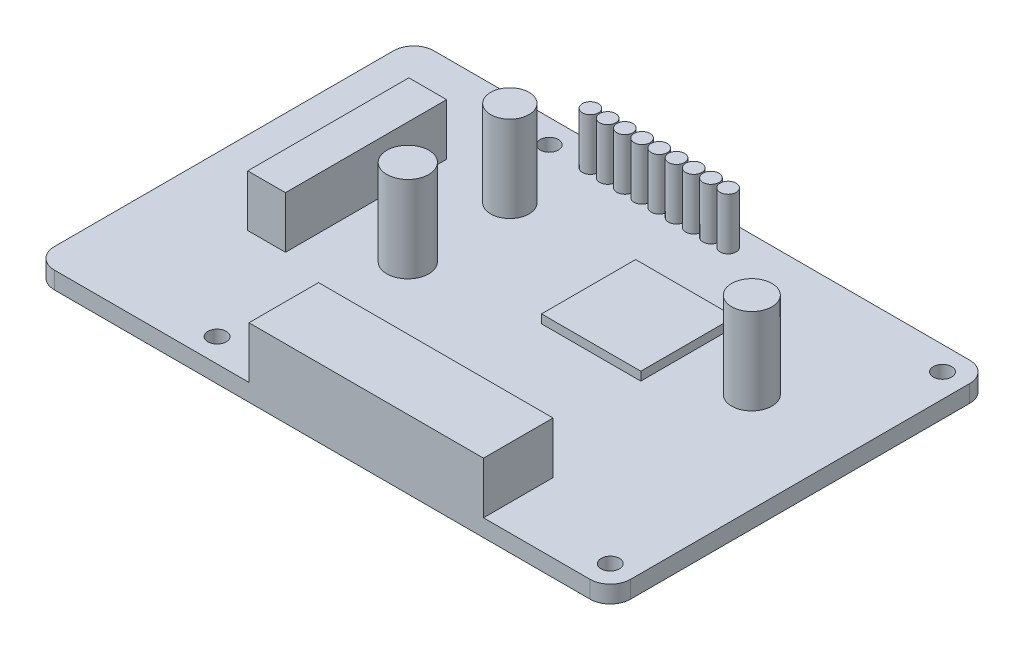
from build123d import *

# Parameters (mm, degrees)
SKETCH1_R           = 1.35
BOSS_EXTRUDE1_DEPTH = 2.54
SKETCH2_W           = 34.5908584
SKETCH2_H           = 10.2596717
BOSS_EXTRUDE2_DEPTH = 7.62
SKETCH3_W           = 5.570985132
SKETCH3_H           = 23.769243549
BOSS_EXTRUDE3_DEPTH = 7.62
SKETCH4_W           = 14.639482868
SKETCH4_H           = 13.879415804
BOSS_EXTRUDE4_DEPTH = 1.27
SKETCH5_R           = 1.180885515
BOSS_EXTRUDE5_DEPTH = 7.62
SKETCH6_R           = 2.837726638
SKETCH6_R_2         = 3.093496415
SKETCH6_R_3         = 2.974585048
BOSS_EXTRUDE6_DEPTH = 12.7


with BuildPart() as part:
    # Sketch1 → Boss-Extrude1 (new body)
    with BuildSketch(Plane(origin=(0, 0, 0), x_dir=(1, 0, 0), z_dir=(0, 1, 0))):
        with BuildLine():
            ThreePointArc((42.5, 25.000002241), (41.621321, 27.121321), (39.500002241, 28))
            Line((39.500002241, 28), (-39.500002241, 28))
            ThreePointArc((-39.500002241, 28), (-41.621321, 27.121321), (-42.5, 25.000002241))
            Line((-42.5, 25.000002241), (-42.5, -25.000002241))
            ThreePointArc((-42.5, -25.000002241), (-41.621321, -27.121321), (-39.500002241, -28))
            Line((-39.500002241, -28), (39.500002241, -28))
            ThreePointArc((39.500002241, -28), (41.621321, -27.121321), (42.5, -25.000002241))
            Line((42.5, -25.000002241), (42.5, 25.000002241))
        make_face()
        with Locations((-19, -24.5)):
            Circle(SKETCH1_R, mode=Mode.SUBTRACT)
        with Locations((39, -24.5)):
            Circle(SKETCH1_R, mode=Mode.SUBTRACT)
        with Locations((-19, 24.5)):
            Circle(SKETCH1_R, mode=Mode.SUBTRACT)
        with Locations((39, 24.5)):
            Circle(SKETCH1_R, mode=Mode.SUBTRACT)
    extrude(amount=BOSS_EXTRUDE1_DEPTH)

    # Sketch2 → Boss-Extrude2 (add)
    with BuildSketch(Plane(origin=(0, 2.54, 0), x_dir=(1, 0, 0), z_dir=(0, 1, 0))):
        with Locations((6.499175034, -22.87016415)):
            Rectangle(SKETCH2_W, SKETCH2_H)
    extrude(amount=BOSS_EXTRUDE2_DEPTH)

    # Sketch3 → Boss-Extrude3 (add)
    with BuildSketch(Plane(origin=(0, 2.54, 0), x_dir=(1, 0, 0), z_dir=(0, 1, 0))):
        with Locations((-27.506444174, 3.193413678)):
            Rectangle(SKETCH3_W, SKETCH3_H)
    extrude(amount=BOSS_EXTRUDE3_DEPTH)

    # Sketch4 → Boss-Extrude4 (add)
    with BuildSketch(Plane(origin=(0, 2.54, 0), x_dir=(1, 0, 0), z_dir=(0, 1, 0))):
        with Locations((10.616389604, 7.997233107)):
            Rectangle(SKETCH4_W, SKETCH4_H)
    extrude(amount=BOSS_EXTRUDE4_DEPTH)

    # Sketch5 → Boss-Extrude5 (add)
    with BuildSketch(Plane(origin=(0, 2.54, 0), x_dir=(1, 0, 0), z_dir=(0, 1, 0))):
        with Locations((-13.019538676, 24.586601174)):
            Circle(SKETCH5_R)
        with Locations((-10.479538676, 24.586601174)):
            Circle(SKETCH5_R)
        with Locations((-7.939538676, 24.586601174)):
            Circle(SKETCH5_R)
        with Locations((-5.399538676, 24.586601174)):
            Circle(SKETCH5_R)
        with Locations((-2.859538676, 24.586601174)):
            Circle(SKETCH5_R)
        with Locations((-0.319538676, 24.586601174)):
            Circle(SKETCH5_R)
        with Locations((2.220461324, 24.586601174)):
            Circle(SKETCH5_R)
        with Locations((4.760461324, 24.586601174)):
            Circle(SKETCH5_R)
        with Locations((7.300461324, 24.586601174)):
            Circle(SKETCH5_R)
    extrude(amount=BOSS_EXTRUDE5_DEPTH)

    # Sketch6 → Boss-Extrude6 (add)
    with BuildSketch(Plane(origin=(0, 2.54, 0), x_dir=(1, 0, 0), z_dir=(0, 1, 0))):
        with Locations((-14.489308001, 14.172406875)):
            Circle(SKETCH6_R)
        with Locations((-14.489308001, -0.87870872)):
            Circle(SKETCH6_R_2)
        with Locations((27.833366931, 7.537539442)):
            Circle(SKETCH6_R_3)
    extrude(amount=BOSS_EXTRUDE6_DEPTH)


solid = part.part
